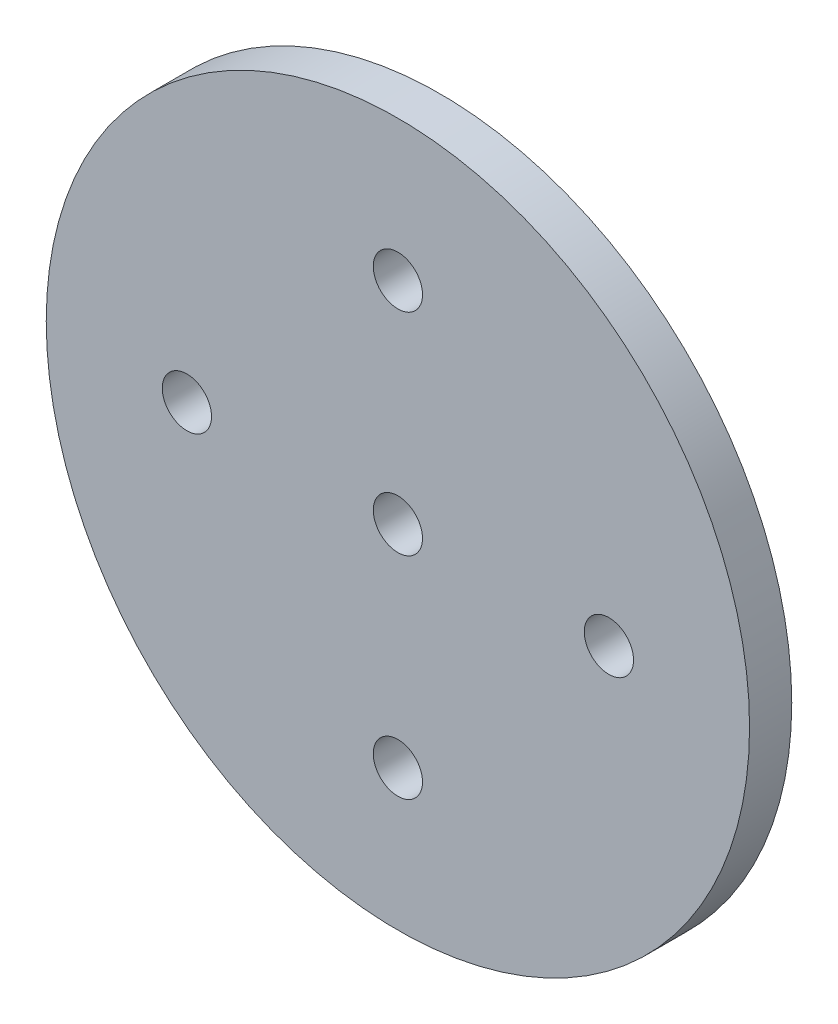
from build123d import *

# Parameters (mm, degrees)
SKETCH_1_R      = 25
SKETCH_1_R_2    = 1.75
EXTRUDE_1_DEPTH = 3


with BuildPart() as part:
    # 草圖1 → 伸長1 (new body)
    with BuildSketch(Plane.XY):
        Circle(SKETCH_1_R)
        Circle(SKETCH_1_R_2, mode=Mode.SUBTRACT)
        with Locations((0, 15)):
            Circle(SKETCH_1_R_2, mode=Mode.SUBTRACT)
        with Locations((15, 0)):
            Circle(SKETCH_1_R_2, mode=Mode.SUBTRACT)
        with Locations((0, -15)):
            Circle(SKETCH_1_R_2, mode=Mode.SUBTRACT)
        with Locations((-15, 0)):
            Circle(SKETCH_1_R_2, mode=Mode.SUBTRACT)
    extrude(amount=EXTRUDE_1_DEPTH)


solid = part.part
